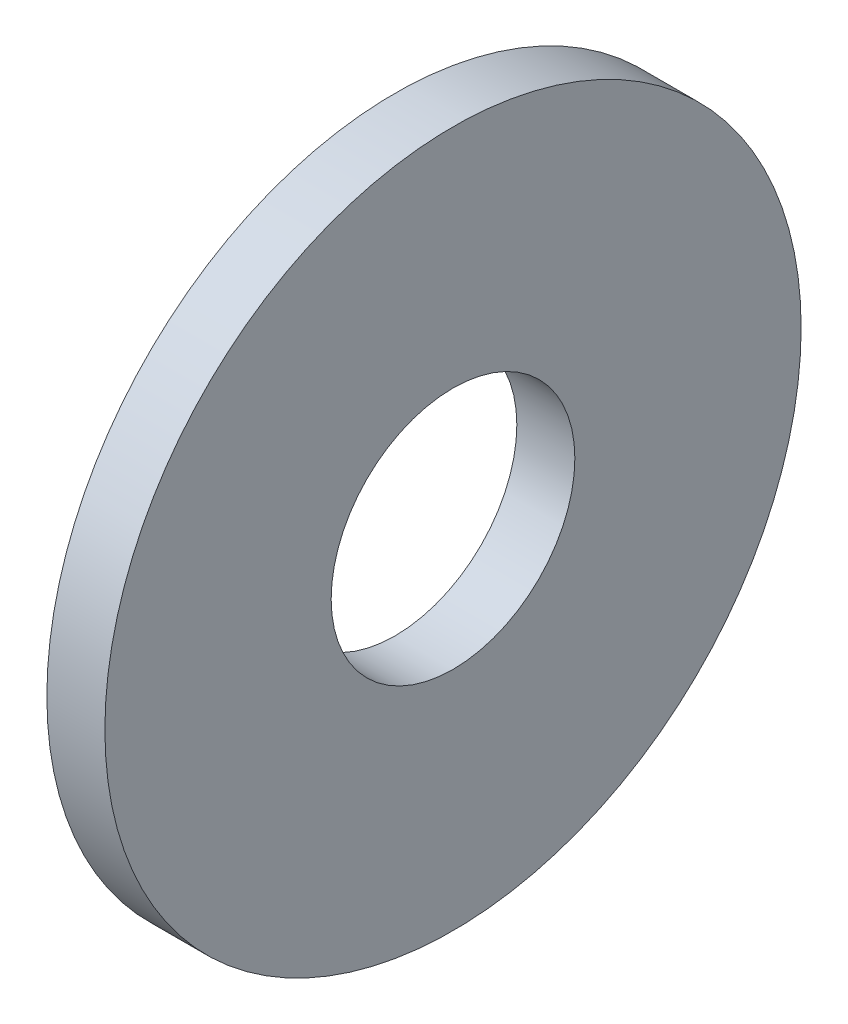
from build123d import *

# Parameters (mm, degrees)
SKETCH1_W = 2
SKETCH1_H = 7.8


with BuildPart() as part:
    # Sketch1 → Base-Revolve (revolve)
    with BuildSketch(Plane.XY, mode=Mode.PRIVATE) as base_revolve_sk:
        with Locations((-1, 8.1)):
            Rectangle(SKETCH1_W, SKETCH1_H)
    revolve(base_revolve_sk.sketch.rotate(Axis((-34.925, 0, 0), (1, 0, 0)), 90), axis=Axis((-34.925, 0, 0), (1, 0, 0)))


solid = part.part
